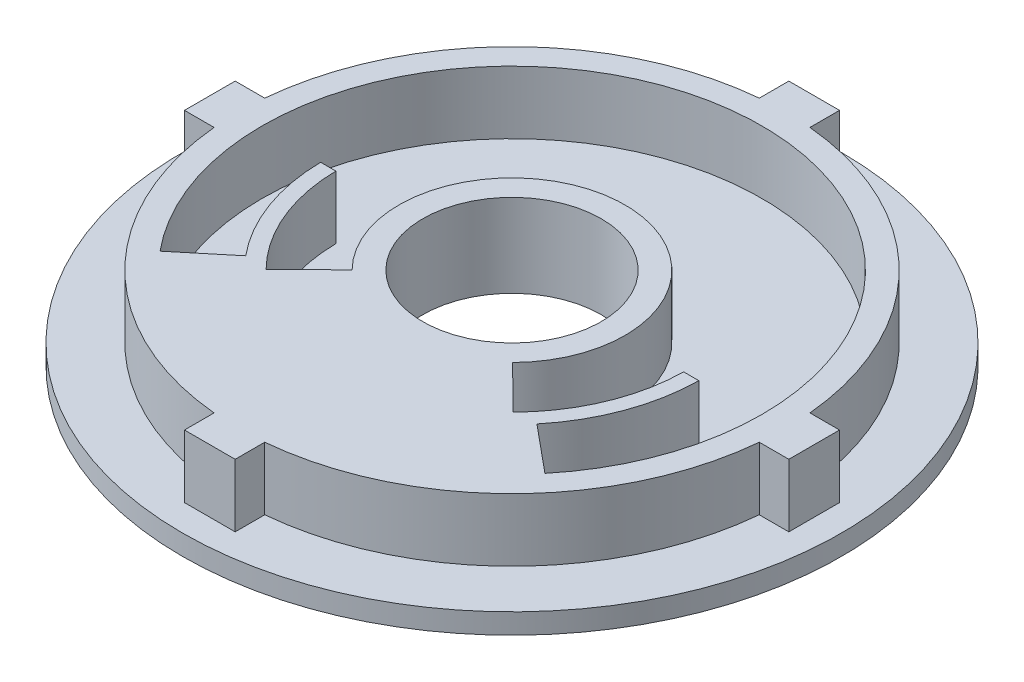
from build123d import *

# Parameters (mm, degrees)
SKETCH1_R           = 27
SKETCH1_R_2         = 8.8
BOSS_EXTRUDE1_DEPTH = 6.2
BOSS_EXTRUDE2_START = 2
SKETCH2_R           = 32.5
SKETCH2_R_2         = 8.8
BOSS_EXTRUDE2_DEPTH = 2
SKETCH3_W           = 5
SKETCH3_H           = 4.39677325
SKETCH3_W_2         = 4.39677325
SKETCH3_H_2         = 5
BOSS_EXTRUDE3_DEPTH = 6.2
BOSS_EXTRUDE4_DEPTH = 6.2


with BuildPart() as part:
    # Sketch1 → Boss-Extrude1 (new body)
    with BuildSketch(Plane(origin=(0, 0, 0), x_dir=(1, 0, 0), z_dir=(0, 1, 0))):
        with Locations(Location((0, 0, 0), (0, 0, 90))):
            Circle(SKETCH1_R)
        with Locations(Location((0, 0, 0), (0, 0, 90))):
            Circle(SKETCH1_R_2, mode=Mode.SUBTRACT)
        with BuildLine():
            Line((-17.5, -17.360083525), (-13.240365112, -13.134505385))
            ThreePointArc((-13.240365112, -13.134505385), (-17.20219229, -7.204656856), (-18.648686612, -0.221331548))
            Line((-18.648686612, -0.221331548), (-17.148571199, -0.221372599))
            ThreePointArc((-17.148571199, -0.221372599), (-15.815189186, -6.633422269), (-12.175456389, -12.07811085))
            Line((-12.175456389, -12.07811085), (-7.915821501, -7.85253271))
            ThreePointArc((-7.915821501, -7.85253271), (0, 11.15), (7.915821501, -7.85253271))
            Line((7.915821501, -7.85253271), (12.175456389, -12.07811085))
            ThreePointArc((12.175456389, -12.07811085), (15.815189186, -6.633422269), (17.148571199, -0.221372599))
            Line((17.148571199, -0.221372599), (18.648686612, -0.221331548))
            ThreePointArc((18.648686612, -0.221331548), (17.20219229, -7.204656856), (13.240365112, -13.134505385))
            Line((13.240365112, -13.134505385), (17.5, -17.360083525))
            ThreePointArc((17.5, -17.360083525), (0, 24.65), (-17.5, -17.360083525))
        make_face(mode=Mode.SUBTRACT)
    extrude(amount=BOSS_EXTRUDE1_DEPTH)

    # Sketch2 → Boss-Extrude2 (add)
    with BuildSketch(Plane.XZ.offset(BOSS_EXTRUDE2_START)):
        with Locations(Location((0, 0, 0), (0, 0, 270))):
            Circle(SKETCH2_R)
        with Locations(Location((0, 0, 0), (0, 0, 270))):
            Circle(SKETCH2_R_2, mode=Mode.SUBTRACT)
    extrude(amount=-BOSS_EXTRUDE2_DEPTH)

    # Sketch3 → Boss-Extrude3 (add)
    with BuildSketch(Plane(origin=(0, 0, 0), x_dir=(1, 0, 0), z_dir=(0, 1, 0))):
        with Locations((0, 27.601613375)):
            Rectangle(SKETCH3_W, SKETCH3_H)
        with Locations((27.601613375, 0)):
            Rectangle(SKETCH3_W_2, SKETCH3_H_2)
        with Locations((0, -27.601613375)):
            Rectangle(SKETCH3_W, SKETCH3_H)
        with Locations((-27.601613375, 0)):
            Rectangle(SKETCH3_W_2, SKETCH3_H_2)
    extrude(amount=BOSS_EXTRUDE3_DEPTH)

    # Sketch5 → Boss-Extrude4 (add)
    with BuildSketch(Plane(origin=(0, 0, 0), x_dir=(1, 0, 0), z_dir=(0, 1, 0))):
        with BuildLine():
            Line((-18.97760125, -15.731279376), (-13.203483223, -10.944886057))
            ThreePointArc((-13.203483223, -10.944886057), (-12.702113744, -11.522968647), (-12.175456389, -12.07811085))
            Line((-12.175456389, -12.07811085), (-17.733930638, -18.204578298))
            Line((-17.733930638, -18.204578298), (-18.97760125, -15.731279376))
        make_face()
    boss_extrude4 = extrude(amount=BOSS_EXTRUDE4_DEPTH)

    # Mirror2: Boss-Extrude4 across plane
    add(boss_extrude4.mirror(Plane(origin=(0, 0, 0), x_dir=(0, 0, 1), z_dir=(1, 0, 0))))


solid = part.part
